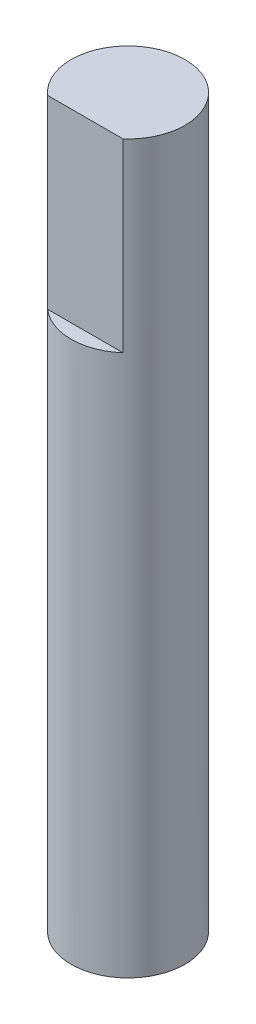
from build123d import *

# Parameters (mm, degrees)
BOSS_EXTRUDE1_DEPTH = 13
BOSS_EXTRUDE2_START = 38
SKETCH2_R           = 4
BOSS_EXTRUDE2_DEPTH = 38


with BuildPart() as part:
    # Sketch1 → Boss-Extrude1 (new body)
    with BuildSketch(Plane(origin=(0, 0, 0), x_dir=(1, 0, 0), z_dir=(0, 1, 0))):
        with BuildLine():
            Line((-2.645751311, -3), (2.645751311, -3))
            ThreePointArc((2.645751311, -3), (0, 4), (-2.645751311, -3))
        make_face()
    extrude(amount=BOSS_EXTRUDE1_DEPTH)

    # Sketch2 → Boss-Extrude2 (add)
    with BuildSketch(Plane.XZ.offset(BOSS_EXTRUDE2_START)):
        with Locations(Location((0, 0, 0), (0, 0, 270))):
            Circle(SKETCH2_R)
    extrude(amount=-BOSS_EXTRUDE2_DEPTH)


solid = part.part
